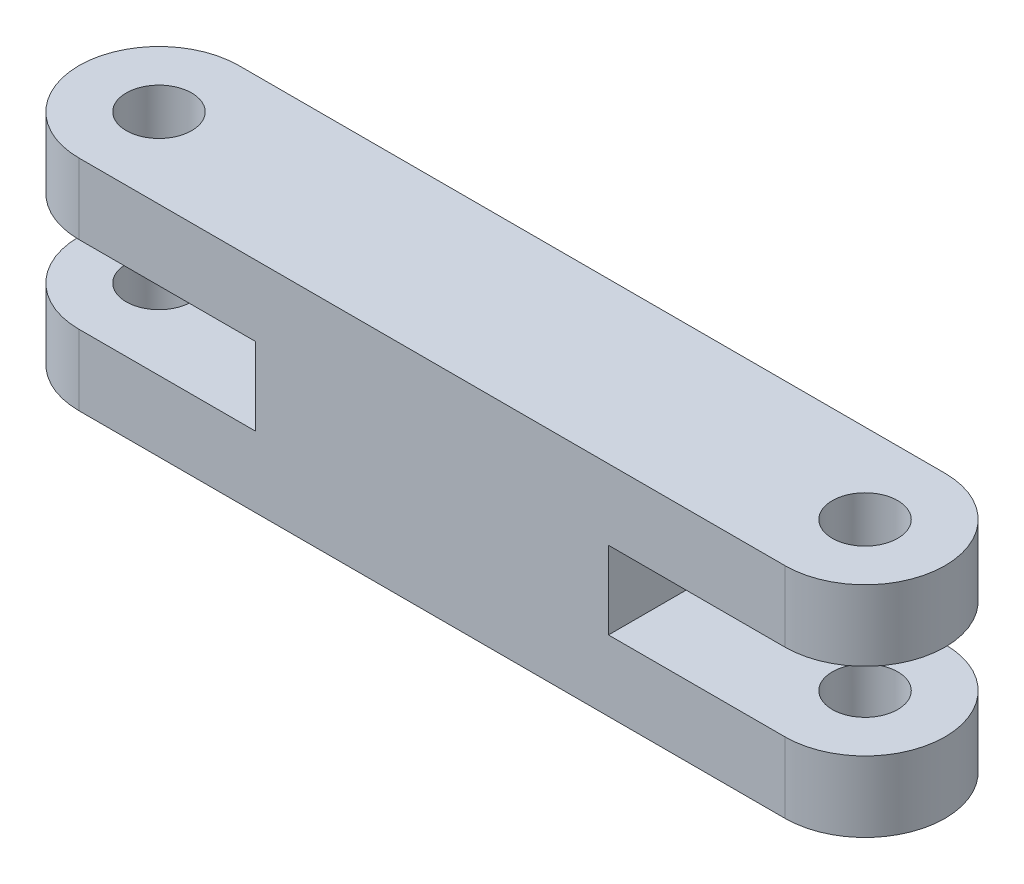
from build123d import *

# Parameters (mm, degrees)
BOSS_EXTRUDE2_DEPTH      = 3.4
BOSS_EXTRUDE2_DEPTH_BACK = 3.4
SKETCH1_W                = 29.999999097
SKETCH1_H                = 9.300000034
SKETCH3_W                = 7.5
SKETCH3_H                = 3.300000034
CUT_EXTRUDE1_DEPTH       = 6.8
SKETCH4_W                = 7.5
SKETCH4_H                = 3.300000034
CUT_EXTRUDE2_DEPTH       = 6.8
BOSS_EXTRUDE3_START      = -3
BOSS_EXTRUDE3_DEPTH      = 3
BOSS_EXTRUDE4_START      = -3
BOSS_EXTRUDE4_DEPTH      = 3
BOSS_EXTRUDE5_START      = -3
BOSS_EXTRUDE5_DEPTH      = 3
BOSS_EXTRUDE6_START      = -3
BOSS_EXTRUDE6_DEPTH      = 3
CUT_EXTRUDE3_START       = -9.3
SKETCH9_R                = 1.39
CUT_EXTRUDE3_DEPTH       = 9.3
CUT_EXTRUDE4_START       = -9.3
SKETCH10_R               = 1.39
CUT_EXTRUDE4_DEPTH       = 9.3


with BuildPart() as part:
    # Sketch1 → Boss-Extrude2 (new, two sides: drawn at the far end of the back side and taken through both)
    with BuildSketch(Plane.XY.offset(-BOSS_EXTRUDE2_DEPTH_BACK)):
        with Locations((18.399999593, -4.650000017)):
            Rectangle(SKETCH1_W, SKETCH1_H)
    extrude(amount=BOSS_EXTRUDE2_DEPTH + BOSS_EXTRUDE2_DEPTH_BACK)

    # Sketch3 → Cut-Extrude1 (cut)
    with BuildSketch(Plane.XY.offset(3.4)):
        with Locations((7.150000045, -4.650000017)):
            Rectangle(SKETCH3_W, SKETCH3_H)
    extrude(amount=-CUT_EXTRUDE1_DEPTH, mode=Mode.SUBTRACT)

    # Sketch4 → Cut-Extrude2 (cut)
    with BuildSketch(Plane.XY.offset(3.4)):
        with Locations((29.649999142, -4.650000017)):
            Rectangle(SKETCH4_W, SKETCH4_H)
    extrude(amount=-CUT_EXTRUDE2_DEPTH, mode=Mode.SUBTRACT)

    # Sketch5 → Boss-Extrude3 (add)
    with BuildSketch(Plane(origin=(0, 0, 0), x_dir=(1, 0, 0), z_dir=(0, 1, 0)).offset(BOSS_EXTRUDE3_START)):
        with BuildLine():
            Line((3.400000045, 3.4), (3.400000045, -3.4))
            ThreePointArc((3.400000045, -3.4), (4.5e-08, 0), (3.400000045, 3.4))
        make_face()
    extrude(amount=BOSS_EXTRUDE3_DEPTH)

    # Sketch6 → Boss-Extrude4 (add)
    with BuildSketch(Plane(origin=(0, 0, 0), x_dir=(1, 0, 0), z_dir=(0, 1, 0)).offset(BOSS_EXTRUDE4_START)):
        with BuildLine():
            Line((33.399999142, 3.4), (33.399999142, -3.4))
            ThreePointArc((33.399999142, -3.4), (36.799999142, 0), (33.399999142, 3.4))
        make_face()
    extrude(amount=BOSS_EXTRUDE4_DEPTH)

    # Sketch7 → Boss-Extrude5 (add)
    with BuildSketch(Plane(origin=(0, -9.300000034, 0), x_dir=(-1, 0, 0), z_dir=(0, -1, 0)).offset(BOSS_EXTRUDE5_START)):
        with BuildLine():
            Line((-3.400000045, -3.4), (-3.400000045, 3.4))
            ThreePointArc((-3.400000045, 3.4), (-4.5e-08, 0), (-3.400000045, -3.4))
        make_face()
    extrude(amount=BOSS_EXTRUDE5_DEPTH)

    # Sketch8 → Boss-Extrude6 (add)
    with BuildSketch(Plane(origin=(0, -9.300000034, 0), x_dir=(-1, 0, 0), z_dir=(0, -1, 0)).offset(BOSS_EXTRUDE6_START)):
        with BuildLine():
            Line((-33.399999142, -3.4), (-33.399999142, 3.4))
            ThreePointArc((-33.399999142, 3.4), (-36.799999142, 0), (-33.399999142, -3.4))
        make_face()
    extrude(amount=BOSS_EXTRUDE6_DEPTH)

    # Sketch9 → Cut-Extrude3 (cut)
    with BuildSketch(Plane(origin=(0, 0, 0), x_dir=(1, 0, 0), z_dir=(0, 1, 0)).offset(CUT_EXTRUDE3_START)):
        with Locations(Location((3.400000045, 0, 0), (0, 0, 270))):
            Circle(SKETCH9_R)
    extrude(amount=CUT_EXTRUDE3_DEPTH, mode=Mode.SUBTRACT)

    # Sketch10 → Cut-Extrude4 (cut)
    with BuildSketch(Plane(origin=(0, 0, 0), x_dir=(1, 0, 0), z_dir=(0, 1, 0)).offset(CUT_EXTRUDE4_START)):
        with Locations(Location((33.399999142, 0, 0), (0, 0, 270))):
            Circle(SKETCH10_R)
    extrude(amount=CUT_EXTRUDE4_DEPTH, mode=Mode.SUBTRACT)


solid = part.part
